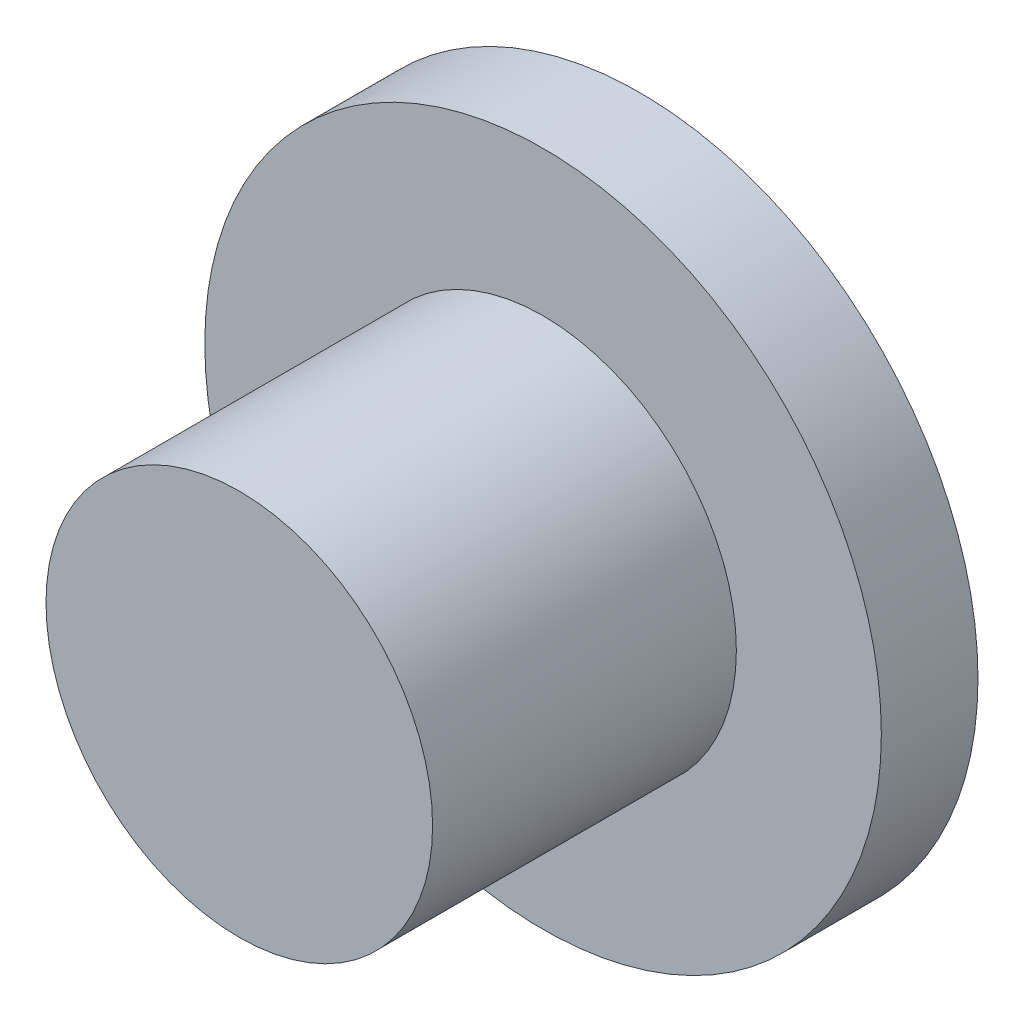
from build123d import *

# Parameters (mm, degrees)
SKETCH1_R           = 2.45
BOSS_EXTRUDE1_DEPTH = 0.7
SKETCH2_R           = 1.4
BOSS_EXTRUDE2_DEPTH = 2.9


with BuildPart() as part:
    # Sketch1 → Boss-Extrude1 (new body)
    with BuildSketch(Plane.XY):
        Circle(SKETCH1_R)
    extrude(amount=BOSS_EXTRUDE1_DEPTH)

    # Sketch2 → Boss-Extrude2 (add)
    with BuildSketch(Plane.XY):
        Circle(SKETCH2_R)
    extrude(amount=BOSS_EXTRUDE2_DEPTH)


solid = part.part
